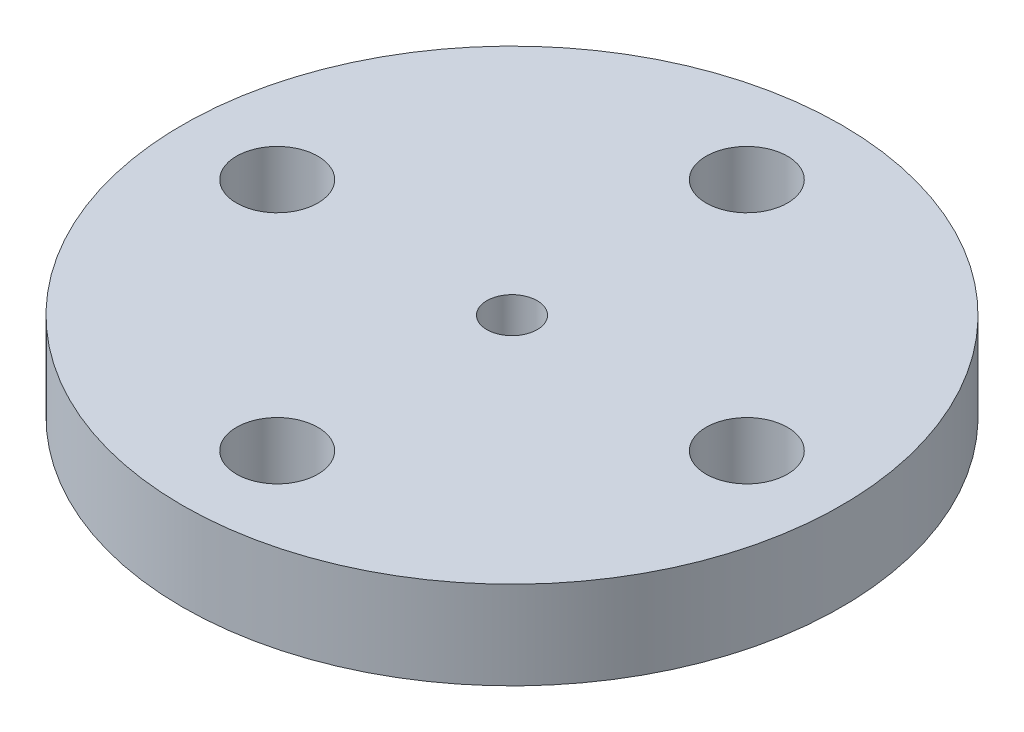
from build123d import *

# Parameters (mm, degrees)
SKETCH6_R           = 9.9822
SKETCH6_R_2         = 1.2319
SKETCH6_R_3         = 0.762
BOSS_EXTRUDE4_DEPTH = 2.667


with BuildPart() as part:
    # Sketch6 → Boss-Extrude4 (new body)
    with BuildSketch(Plane(origin=(0, 0, 0), x_dir=(1, 0, 0), z_dir=(0, 1, 0))):
        with Locations(Location((0, 0, 0), (0, 0, 270))):
            Circle(SKETCH6_R)
        with Locations(Location((-7.112, 0, 0), (0, 0, 270))):
            Circle(SKETCH6_R_2, mode=Mode.SUBTRACT)
        with Locations(Location((0, 7.112, 0), (0, 0, 270))):
            Circle(SKETCH6_R_2, mode=Mode.SUBTRACT)
        with Locations(Location((7.112, 0, 0), (0, 0, 270))):
            Circle(SKETCH6_R_2, mode=Mode.SUBTRACT)
        with Locations(Location((0, -7.112, 0), (0, 0, 270))):
            Circle(SKETCH6_R_2, mode=Mode.SUBTRACT)
        with Locations(Location((0, 0, 0), (0, 0, 270))):
            Circle(SKETCH6_R_3, mode=Mode.SUBTRACT)
    extrude(amount=BOSS_EXTRUDE4_DEPTH)


solid = part.part
